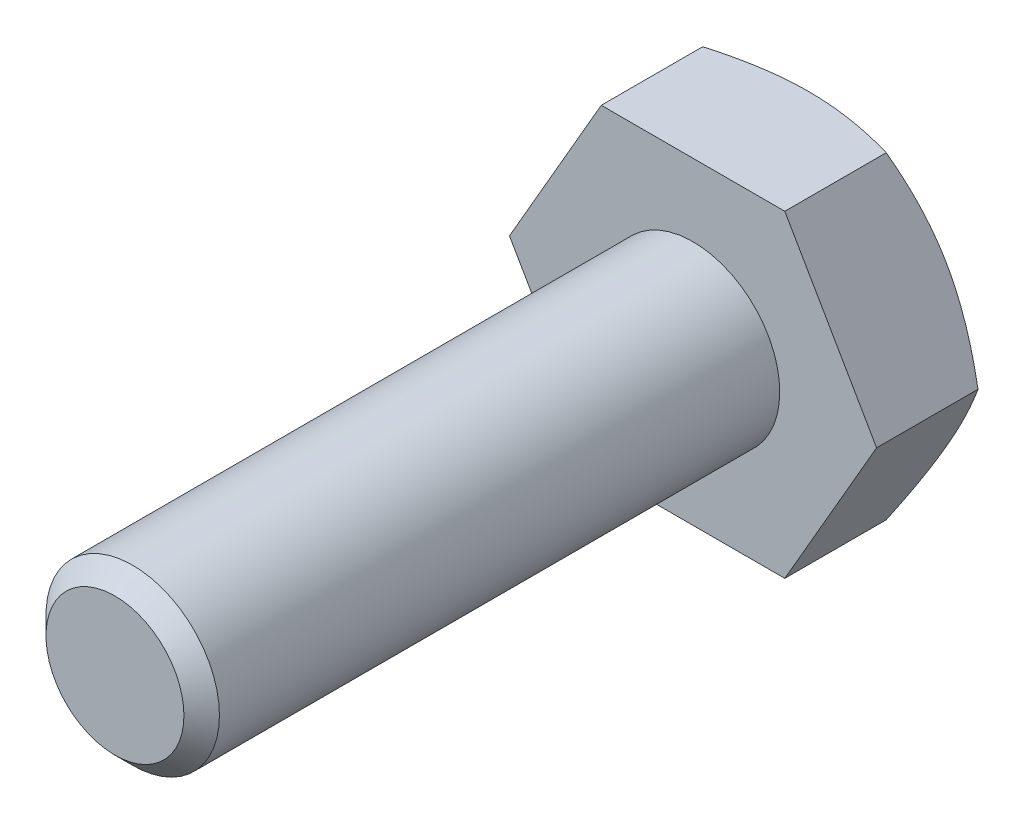
from build123d import *

# Parameters (mm, degrees)
EXTRUDE1_DEPTH = 2
SKETCH2_R      = 1.5
EXTRUDE2_DEPTH = 10
CHAMFER1_SIZE  = 0.307


with BuildPart() as part:
    # Sketch1 → Extrude1 (new body)
    with BuildSketch(Plane.XY):
        Polygon((3.175426481, 0), (1.58771324, 2.75), (-1.58771324, 2.75), (-3.175426481, 0), (-1.58771324, -2.75), (1.58771324, -2.75), align=None)
    extrude(amount=EXTRUDE1_DEPTH)

    # Sketch2 → Extrude2 (add)
    with BuildSketch(Plane.XY.offset(2)):
        Circle(SKETCH2_R)
    extrude(amount=EXTRUDE2_DEPTH)

    # Sketch3 → Cut-Revolve1 (revolve, cut)
    with BuildSketch(Plane(origin=(0, 0, 0), x_dir=(0, 0, -1), z_dir=(1, 0, 0))):
        Polygon((0, 2.75), (0, 102.75), (-57.735026919, 102.75), align=None)
    revolve(axis=Axis((0, 0, 0), (0, 0, -1)), mode=Mode.SUBTRACT)

    # Chamfer1
    chamfer1_edges = [part.edges().sort_by_distance(p)[0] for p in [
        (-1.5, 0, 12),
    ]]
    chamfer(chamfer1_edges, length=CHAMFER1_SIZE)


solid = part.part
